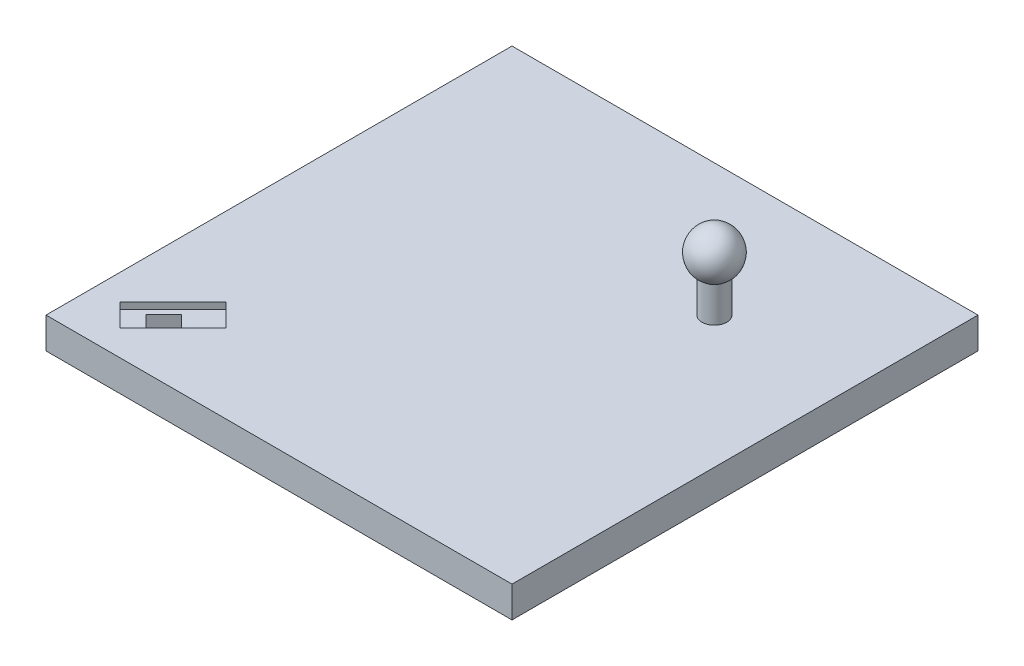
from build123d import *

# Parameters (mm, degrees)
SKETCH1_W               = 150
SKETCH1_H               = 150
BOSS_EXTRUDE1_DEPTH     = 10
CUT_EXTRUDE1_DEPTH      = 3.1
CUT_EXTRUDE1_DEPTH_BACK = 3.1
CUT_EXTRUDE2_DEPTH      = 8.2
CUT_EXTRUDE2_DEPTH_BACK = 2
SKETCH4_W               = 24.2
SKETCH4_H               = 2


with BuildPart() as part:
    # Sketch1 → Boss-Extrude1 (new body)
    with BuildSketch(Plane(origin=(0, 0, 0), x_dir=(1, 0, 0), z_dir=(0, 1, 0))):
        Rectangle(SKETCH1_W, SKETCH1_H)
    extrude(amount=BOSS_EXTRUDE1_DEPTH)

    # Sketch3 → Cut-Extrude1 (cut, two sides: drawn at the far end of the back side and taken through both)
    with BuildSketch(Plane(origin=(0, 0, 0), x_dir=(0, -1, 0), z_dir=(0.7071067811865488, 0, 0.7071067811865464)).offset(-CUT_EXTRUDE1_DEPTH_BACK)):
        with BuildLine():
            Line((-4, -68.177876041), (-6, -68.177876041))
            ThreePointArc((-6, -68.177876041), (-6.294051831, -69.777876041), (-6, -71.377876041))
            Line((-6, -71.377876041), (-6, -75.277876041))
            Line((-6, -75.277876041), (-8, -75.277876041))
            Line((-8, -75.277876041), (-8, -65.077876041))
            Line((-8, -65.077876041), (-10, -65.077876041))
            Line((-10, -65.077876041), (-10, -89.277876041))
            Line((-10, -89.277876041), (-8, -89.277876041))
            Line((-8, -89.277876041), (-8, -83.277876041))
            Line((-8, -83.277876041), (-4, -83.277876041))
            Line((-4, -83.277876041), (-4, -71.377876041))
            ThreePointArc((-4, -71.377876041), (-3.705948169, -69.777876041), (-4, -68.177876041))
        make_face()
    extrude(amount=CUT_EXTRUDE1_DEPTH + CUT_EXTRUDE1_DEPTH_BACK, mode=Mode.SUBTRACT)

    # Sketch4 → Cut-Extrude2 (cut, two sides: drawn at the far end of the back side and taken through both)
    with BuildSketch(Plane(origin=(-2.192031022, 0, -2.192031022), x_dir=(0.7071067811865465, 0, -0.7071067811865487), z_dir=(0.7071067811865487, 0, 0.7071067811865465)).offset(-CUT_EXTRUDE2_DEPTH_BACK)):
        with Locations((-77.177876041, 9)):
            Rectangle(SKETCH4_W, SKETCH4_H)
    extrude(amount=CUT_EXTRUDE2_DEPTH + CUT_EXTRUDE2_DEPTH_BACK, mode=Mode.SUBTRACT)

    # Sketch5 → Revolve1 (revolve)
    with BuildSketch(Plane(origin=(0, 0, 0), x_dir=(0, -1, 0), z_dir=(0.7071067811865488, 0, 0.7071067811865464))):
        with BuildLine():
            Line((-10, 46.066017178), (-35, 46.066017178))
            ThreePointArc((-35, 46.066017178), (-29.607626316, 53.030055538), (-21.31365255, 50.066017178))
            Line((-21.31365255, 50.066017178), (-10, 50.066017178))
            Line((-10, 50.066017178), (-10, 46.066017178))
        make_face()
    revolve(axis=Axis((32.573593129, 36.96807126, -32.573593129), (0, -1, 0)))


solid = part.part
